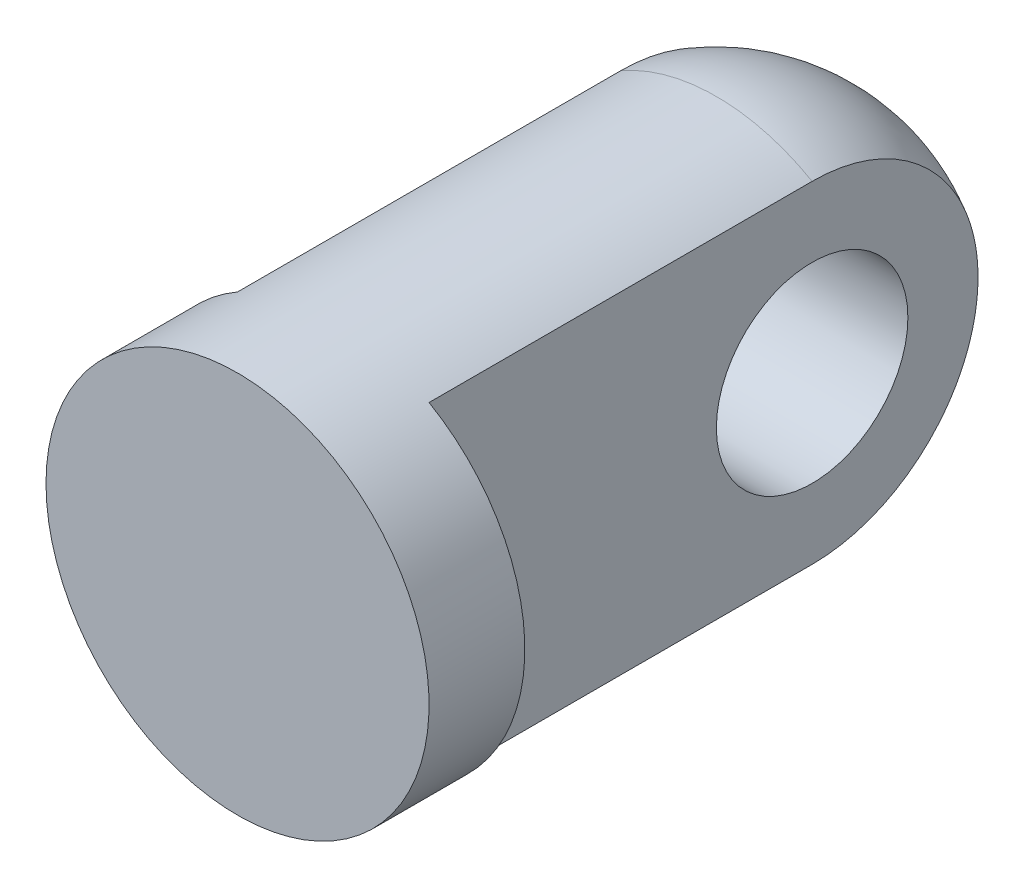
from build123d import *

# Parameters (mm, degrees)
SKETCH2_W          = 12.7
SKETCH2_H          = 60.004179461
CUT_EXTRUDE1_DEPTH = 24.970724332
SKETCH3_R          = 3.175
CUT_EXTRUDE2_DEPTH = 25.999975


with BuildPart() as part:
    # Sketch1 → Revolve1 (revolve)
    with BuildSketch(Plane(origin=(0, 0, 0), x_dir=(1, 0, 0), z_dir=(0, 1, 0)), mode=Mode.PRIVATE) as revolve1_sk:
        with BuildLine():
            Line((0, 0), (0, 15.875))
            Line((0, 15.875), (0, 22.225))
            ThreePointArc((0, 22.225), (4.490128061, 20.365128061), (6.35, 15.875))
            Line((6.35, 15.875), (6.35, 0))
            Line((6.35, 0), (0, 0))
        make_face()
    revolve(revolve1_sk.sketch.rotate(Axis((0, 0, -22.225), (0, 0, 1)), 180), axis=Axis((0, 0, -22.225), (0, 0, 1)))

    # Sketch2 → Cut-Extrude1 (cut, symmetric)
    with BuildSketch(Plane(origin=(0, 0, 0), x_dir=(1, 0, 0), z_dir=(0, 1, 0))):
        with Locations((-9.525, 33.177089731)):
            Rectangle(SKETCH2_W, SKETCH2_H)
    cut_extrude1 = extrude(amount=CUT_EXTRUDE1_DEPTH, both=True, mode=Mode.SUBTRACT)

    # Mirror1: Cut-Extrude1 across plane
    add(cut_extrude1.mirror(Plane(origin=(0, 0, 0), x_dir=(0, 0, 1), z_dir=(1, 0, 0))), mode=Mode.SUBTRACT)

    # Sketch3 → Cut-Extrude2 (cut, through all)
    with BuildSketch(Plane.ZY.offset(3.175)):
        with Locations((-15.875, 0)):
            Circle(SKETCH3_R)
    extrude(amount=-CUT_EXTRUDE2_DEPTH, mode=Mode.SUBTRACT)


solid = part.part
